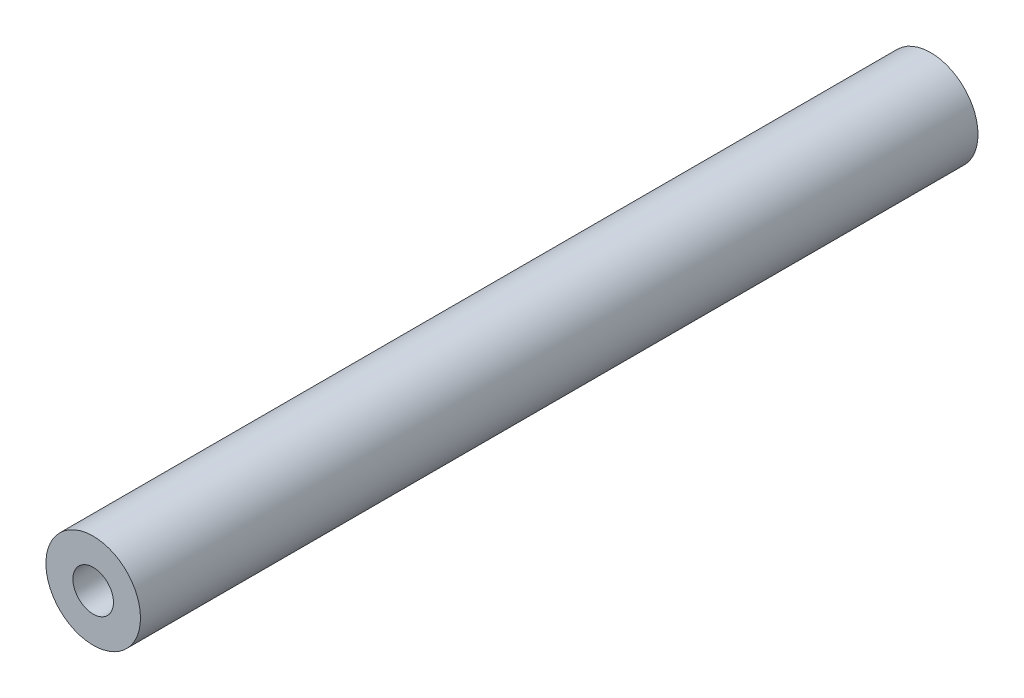
from build123d import *

# Parameters (mm, degrees)
SKETCH1_R           = 3.5
SKETCH1_R_2         = 1.5
BOSS_EXTRUDE1_DEPTH = 62


with BuildPart() as part:
    # Sketch1 → Boss-Extrude1 (new body)
    with BuildSketch(Plane.XY):
        Circle(SKETCH1_R)
        Circle(SKETCH1_R_2, mode=Mode.SUBTRACT)
    extrude(amount=BOSS_EXTRUDE1_DEPTH)


solid = part.part
